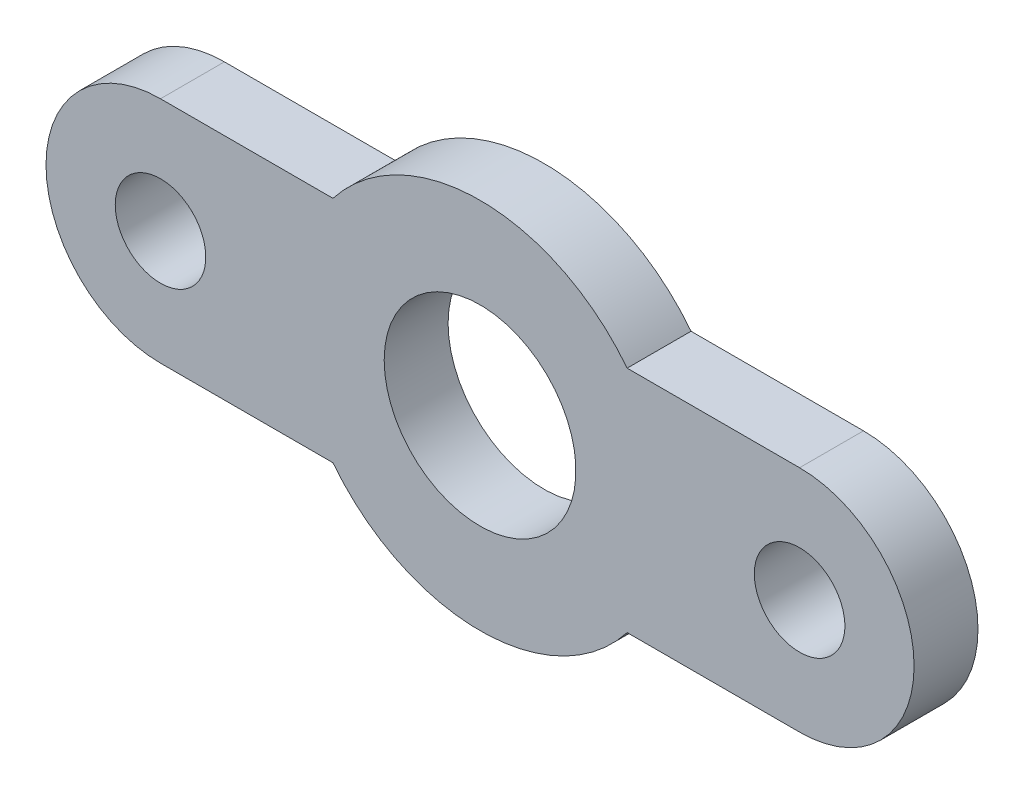
from build123d import *

# Parameters (mm, degrees)
F_01_REMOVABLE_TWO_BOLT_NUT_KEEPER_DEPTH       = 2.4
S02_NUT_RETAINING_FACE_R                       = 7
F_02_NUT_RETAINING_FACE_DEPTH                  = 2.4
F_03_START                                     = -0.1
S03_SCREW_END_AND_TWO_M3_FASTENER_HOLE_R       = 3.6
S03_SCREW_END_AND_TWO_M3_FASTENER_HOLE_R_2     = 1.7
F_03_SCREW_END_AND_TWO_M3_FASTENER_HOLES_DEPTH = 2.6


with BuildPart() as part:
    # S01 - Removable two-bolt nut keeper → 01 - Removable two-bolt nut keeper (new body)
    with BuildSketch(Plane.XY):
        with BuildLine():
            Line((-12, 4.3), (12, 4.3))
            ThreePointArc((12, 4.3), (16.3, 0), (12, -4.3))
            Line((12, -4.3), (-12, -4.3))
            ThreePointArc((-12, -4.3), (-16.3, 0), (-12, 4.3))
        make_face()
    extrude(amount=F_01_REMOVABLE_TWO_BOLT_NUT_KEEPER_DEPTH)

    # S02 - Nut retaining face → 02 - Nut retaining face (add)
    with BuildSketch(Plane.XY):
        Circle(S02_NUT_RETAINING_FACE_R)
    extrude(amount=F_02_NUT_RETAINING_FACE_DEPTH)

    # S03 - Screw end and two M3 fastener holes → 03 - Screw end and two M3 fastener holes (cut)
    with BuildSketch(Plane.XY.offset(F_03_START)):
        with Locations(Location((0, 0, 0), (0, 0, 180))):
            Circle(S03_SCREW_END_AND_TWO_M3_FASTENER_HOLE_R)
        with Locations(Location((-12, 0, 0), (0, 0, 180))):
            Circle(S03_SCREW_END_AND_TWO_M3_FASTENER_HOLE_R_2)
        with Locations(Location((12, 0, 0), (0, 0, 180))):
            Circle(S03_SCREW_END_AND_TWO_M3_FASTENER_HOLE_R_2)
    extrude(amount=F_03_SCREW_END_AND_TWO_M3_FASTENER_HOLES_DEPTH, mode=Mode.SUBTRACT)


solid = part.part
